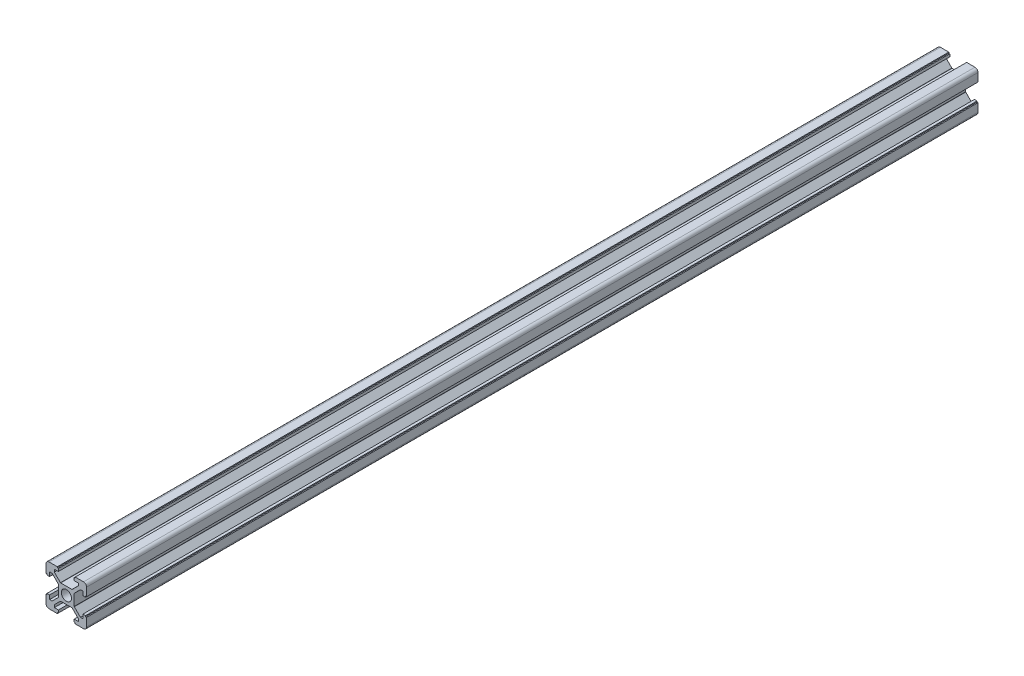
from build123d import *

# Parameters (mm, degrees)
SKETCH_1_R      = 2.5
EXTRUDE_1_DEPTH = 439
FILLET_1_R      = 1.5
FILLET_2_R      = 0.2


with BuildPart() as part:
    # 草图1 → 凸台-拉伸1 (new body)
    with BuildSketch(Plane.XY):
        Polygon((-10, 10), (-4.4, 10), (-4.4, 9.5), (-3.9, 9.5), (-3.9, 8.2), (-5.9, 8.2), (-5.9, 6.960660172), (-2.839608303, 3.900131414), (2.839471243, 3.900131414), (5.9, 6.960660172), (5.9, 8.2), (3.9, 8.2), (3.9, 9.5), (4.4, 9.5), (4.4, 10), (10, 10), (10, 4.4), (9.5, 4.4), (9.5, 3.9), (8.2, 3.9), (8.2, 5.9), (6.960660172, 5.9), (3.900131414, 2.839608303), (3.900131414, -2.839471243), (6.960660172, -5.9), (8.2, -5.9), (8.2, -3.9), (9.5, -3.9), (9.5, -4.4), (10, -4.4), (10, -10), (4.4, -10), (4.4, -9.5), (3.9, -9.5), (3.9, -8.2), (5.9, -8.2), (5.9, -6.960660172), (2.839471243, -3.899994348), (-2.839334176, -3.899994348), (-5.9, -6.960660172), (-5.9, -8.2), (-3.9, -8.2), (-3.9, -9.5), (-4.4, -9.5), (-4.4, -10), (-10, -10), (-10, -4.4), (-9.5, -4.4), (-9.5, -3.9), (-8.2, -3.9), (-8.2, -5.9), (-6.960660172, -5.9), (-3.899994348, -2.839471243), (-3.899994348, 2.839334176), (-6.960660172, 5.9), (-8.2, 5.9), (-8.2, 3.9), (-9.5, 3.9), (-9.5, 4.4), (-10, 4.4), align=None)
        with Locations((0.02838442, -0.01419221)):
            Circle(SKETCH_1_R, mode=Mode.SUBTRACT)
    extrude(amount=EXTRUDE_1_DEPTH)

    # 圆角1
    fillet_1_edges = [part.edges().sort_by_distance(p)[0] for p in [
        (10, 10, 219.5),
        (10, -10, 219.5),
        (-10, -10, 219.5),
        (-10, 10, 219.5),
    ]]
    fillet(fillet_1_edges, radius=FILLET_1_R)

    # 圆角2
    fillet_2_edges = [part.edges().sort_by_distance(p)[0] for p in [
        (3.900131414, 2.839608303, 219.5),
        (3.900131414, -2.839471243, 219.5),
        (2.839471243, -3.899994348, 219.5),
        (-2.839334176, -3.899994348, 219.5),
        (-3.899994348, -2.839471243, 219.5),
        (-3.899994348, 2.839334176, 219.5),
        (-2.839608303, 3.900131414, 219.5),
        (2.839471243, 3.900131414, 219.5),
    ]]
    fillet(fillet_2_edges, radius=FILLET_2_R)


solid = part.part
